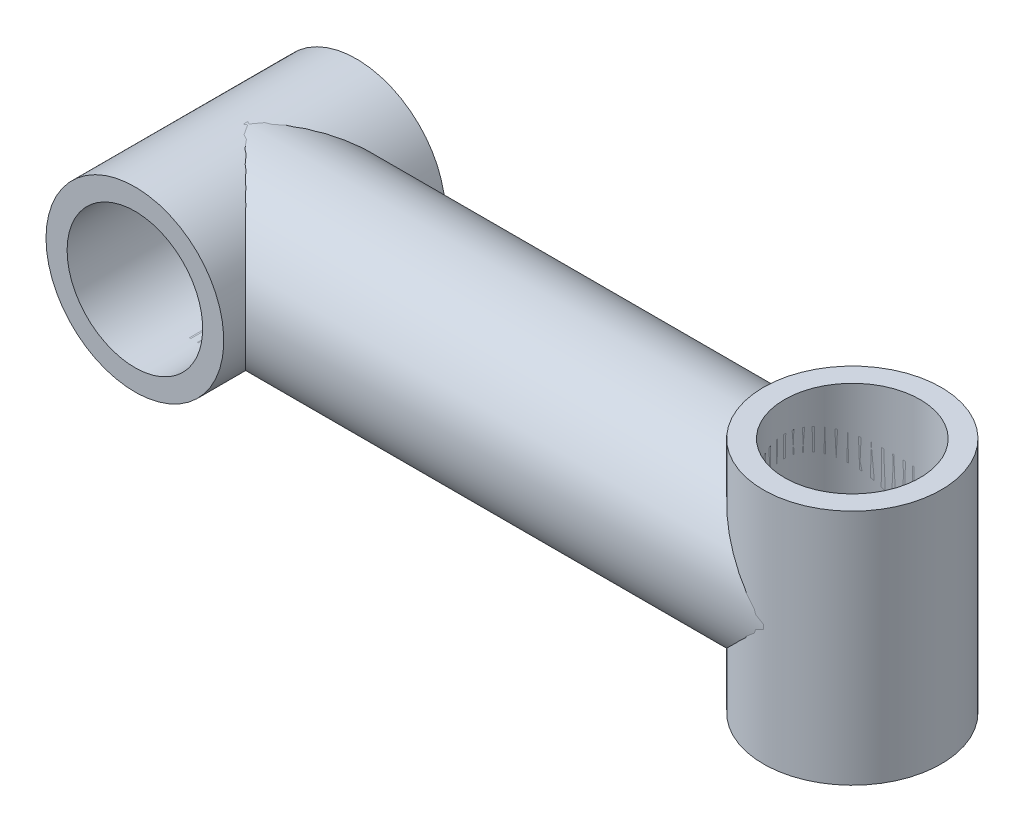
from build123d import *

# Parameters (mm, degrees)
SKETCH1_R                 = 16.85
SKETCH1_R_2               = 12.85
PIPE_33_7_X_4_0_1_DEPTH   = 42
SKETCH14_R                = 16.85
SKETCH14_R_2              = 12.85
PIPE_33_7_X_4_0_1_2_DEPTH = 115
SKETCH9_R                 = 16.85
SKETCH9_R_2               = 12.85
PIPE_33_7_X_4_0_2_DEPTH   = 45
SKETCH11_R                = 12.85
CUT_EXTRUDE2_DEPTH        = 141.195122954
CUT_EXTRUDE3_DEPTH        = 141.891527424
CUT_EXTRUDE3_DEPTH_BACK   = 141.891527424
SKETCH12_R                = 12.85


with BuildPart() as part:
    # Sketch1 → Pipe 33.7 X 4.0_1 (new body)
    with BuildSketch(Plane.XY.offset(-21)):
        Circle(SKETCH1_R)
        Circle(SKETCH1_R_2, mode=Mode.SUBTRACT)
    extrude(amount=PIPE_33_7_X_4_0_1_DEPTH)


with BuildPart() as body_2:
    # Sketch14 → Pipe 33.7 X 4.0_1 2 (new body)
    with BuildSketch(Plane(origin=(0, 0, 0), x_dir=(0, 0, -1), z_dir=(1, 0, 0))):
        Circle(SKETCH14_R)
        Circle(SKETCH14_R_2, mode=Mode.SUBTRACT)
    extrude(amount=PIPE_33_7_X_4_0_1_2_DEPTH)

    # Sketch11 → Cut-Extrude2 (cut, through all)
    with BuildSketch(Plane.XY.offset(21)):
        with Locations(Location((0, 0, 0), (0, 0, 180))):
            Circle(SKETCH11_R)
    extrude(amount=-CUT_EXTRUDE2_DEPTH, mode=Mode.SUBTRACT)

    # Sketch12 → Cut-Extrude3 (cut, two sides: drawn at the far end of the back side and taken through both)
    with BuildSketch(Plane.XZ.offset(22.5).offset(-CUT_EXTRUDE3_DEPTH_BACK)):
        with Locations(Location((115, 0, 0), (0, 0, 180))):
            Circle(SKETCH12_R)
    extrude(amount=CUT_EXTRUDE3_DEPTH + CUT_EXTRUDE3_DEPTH_BACK, mode=Mode.SUBTRACT)


with BuildPart() as body_3:
    # Sketch9 → Pipe 33.7 X 4.0(2) (new body)
    with BuildSketch(Plane(origin=(115, 22.5, 0), x_dir=(1, 0, 0), z_dir=(0, -1, 0))):
        Circle(SKETCH9_R)
        Circle(SKETCH9_R_2, mode=Mode.SUBTRACT)
    extrude(amount=PIPE_33_7_X_4_0_2_DEPTH)


solid = Compound([part.part, body_2.part, body_3.part])
